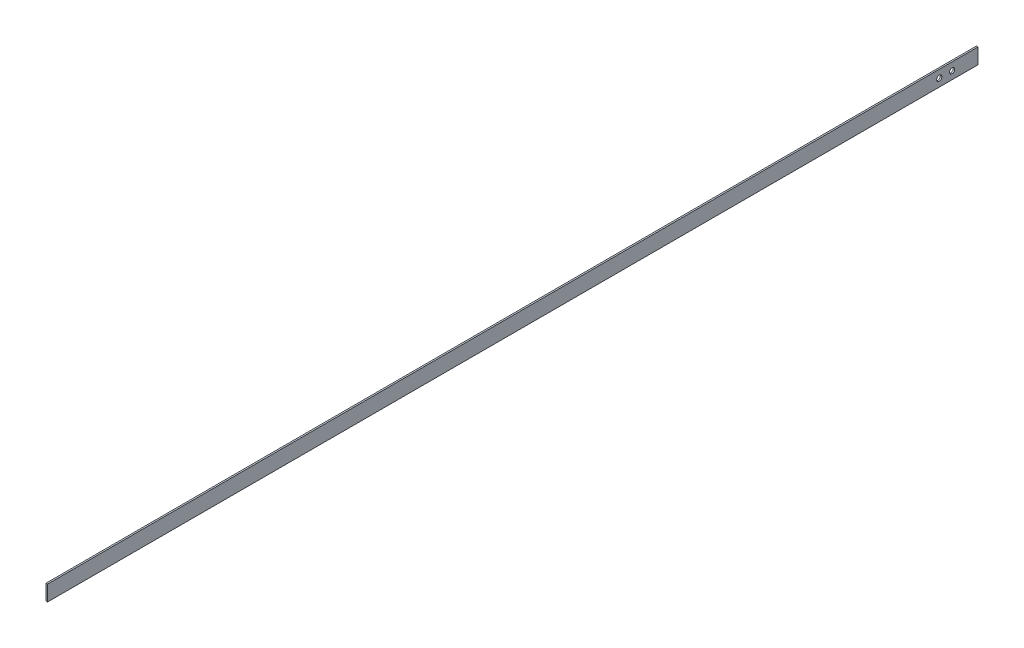
from build123d import *

# Parameters (mm, degrees)
SKETCH1_W                = 0.3
SKETCH1_H                = 3
BOSS_EXTRUDE1_DEPTH      = 180
F_1_0_1_DIAMETER_HOLE1_D = 1


with BuildPart() as part:
    # Sketch1 → Boss-Extrude1 (new body)
    with BuildSketch(Plane.XY):
        Rectangle(SKETCH1_W, SKETCH1_H)
    extrude(amount=BOSS_EXTRUDE1_DEPTH)

    # Ø1.0 (1) Diameter Hole1 (through all)
    with Locations(Plane(origin=(0.15, 0, 0), x_dir=(0, 0, -1), z_dir=(1, 0, 0))):
        with Locations((-7.5, 0), (-5, 0)):
            Hole(F_1_0_1_DIAMETER_HOLE1_D / 2)


solid = part.part
